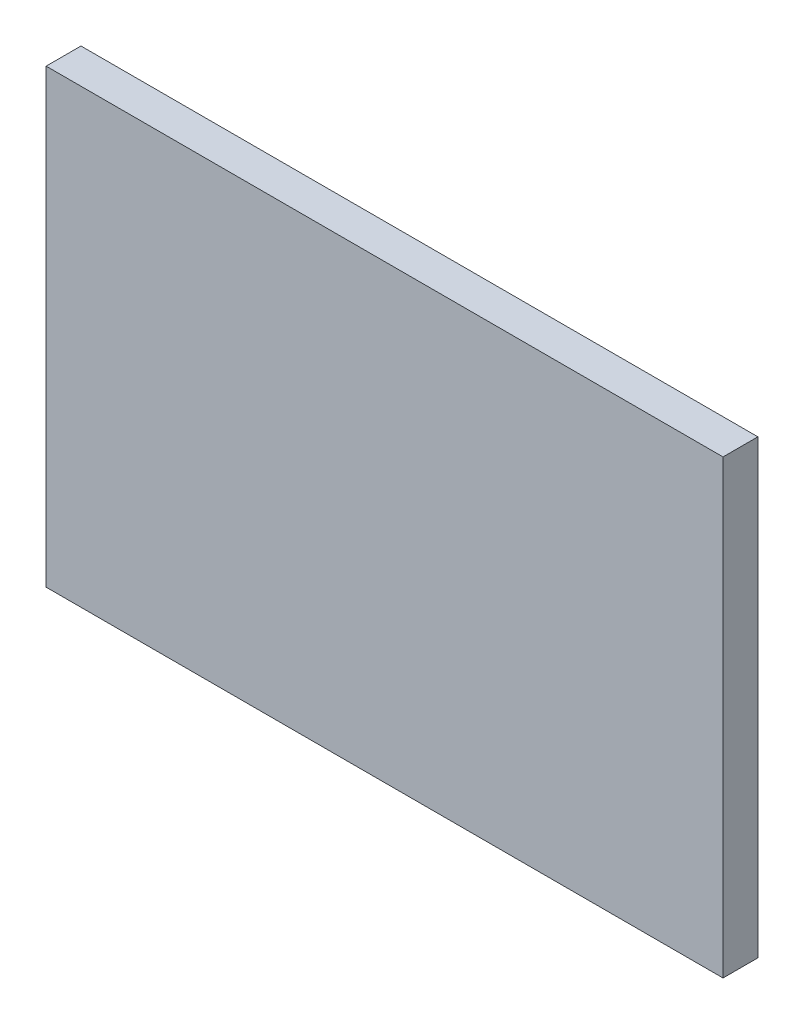
from build123d import *

# Parameters (mm, degrees)
SKETCH_1_W      = 3885
SKETCH_1_H      = 2590
EXTRUDE_1_DEPTH = 200


with BuildPart() as part:
    # Эскиз1 → Бобышка-Вытянуть1 (new body)
    with BuildSketch(Plane.XY):
        Rectangle(SKETCH_1_W, SKETCH_1_H)
    extrude(amount=EXTRUDE_1_DEPTH)


solid = part.part
